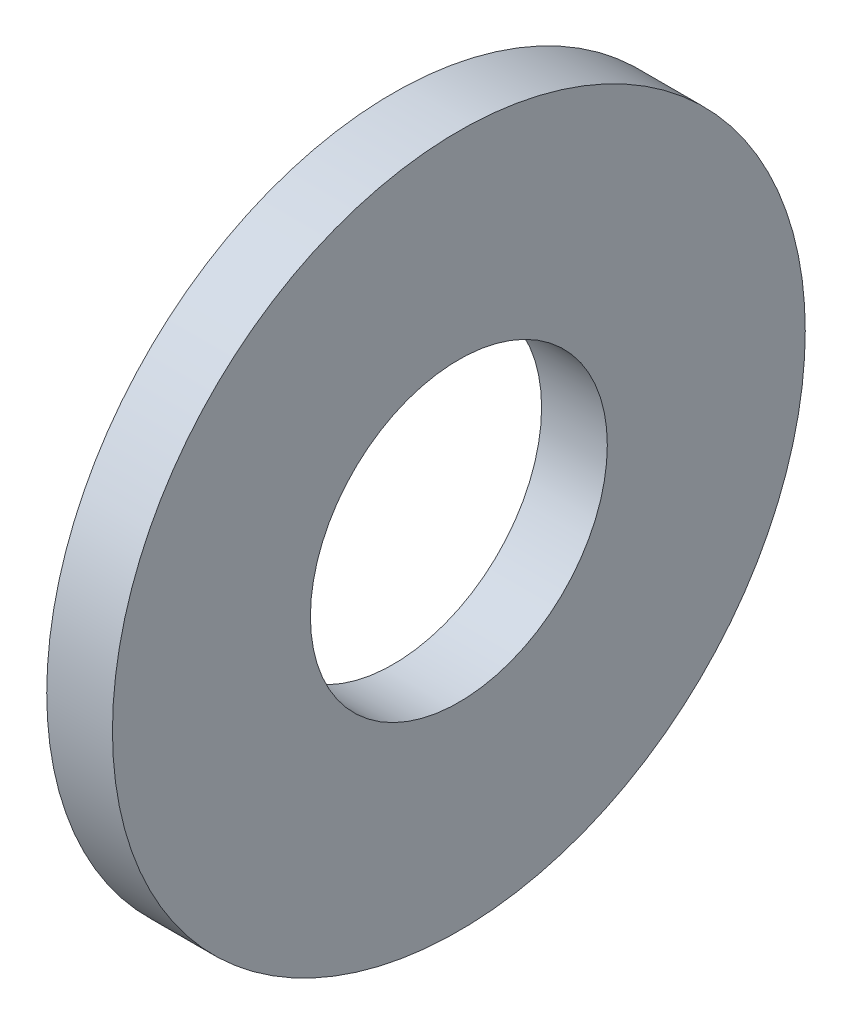
from build123d import *

# Parameters (mm, degrees)
SKETCH1_W = 2.1082
SKETCH1_H = 6.35


with BuildPart() as part:
    # Sketch1 → Base-Revolve (revolve)
    with BuildSketch(Plane.XY, mode=Mode.PRIVATE) as base_revolve_sk:
        with Locations((-1.0541, 7.9375)):
            Rectangle(SKETCH1_W, SKETCH1_H)
    revolve(base_revolve_sk.sketch.rotate(Axis((-34.925, 0, 0), (1, 0, 0)), 90), axis=Axis((-34.925, 0, 0), (1, 0, 0)))


solid = part.part
